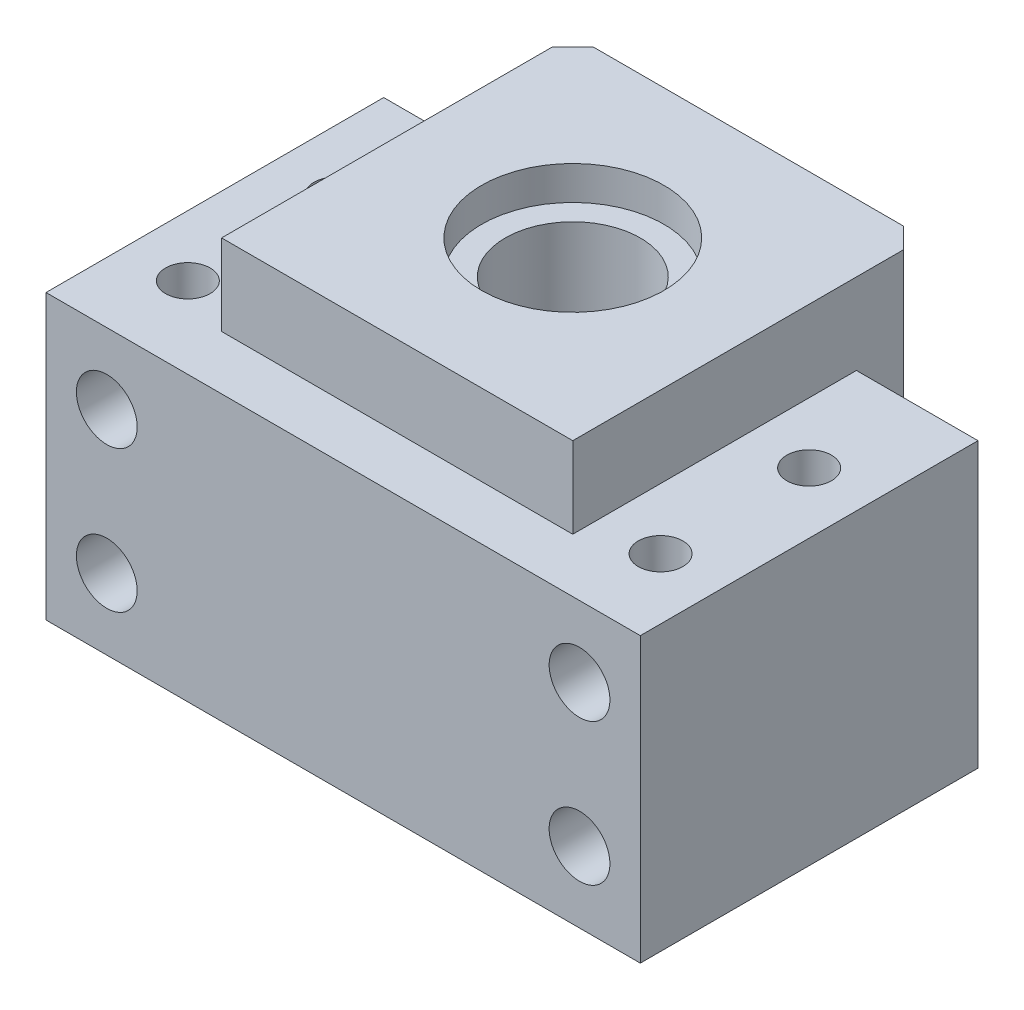
from build123d import *

# Parameters (mm, degrees)
SKETCH_1_W          = 88
SKETCH_1_H          = 50
SKETCH_1_R          = 3.3
EXTRUDE_1_DEPTH     = 42
SKETCH_2_W          = 52
SKETCH_2_H          = 52
EXTRUDE_2_DEPTH     = 54
SKETCH_3_R          = 7
CUT_EXTRUDE_1_DEPTH = 12
SKETCH_4_R          = 4.5
CUT_EXTRUDE_2_DEPTH = 80.3473377
SKETCH_5_R          = 10
CUT_EXTRUDE_3_DEPTH = 78.955115291
SKETCH_6_R          = 13.5
CUT_EXTRUDE_4_DEPTH = 5
CHAMFER_1_SIZE      = 3


with BuildPart() as part:
    # 草图1 → 凸台-拉伸1 (new body)
    with BuildSketch(Plane(origin=(0, 0, 0), x_dir=(1, 0, 0), z_dir=(0, 1, 0))):
        Rectangle(SKETCH_1_W, SKETCH_1_H)
        with Locations(Location((35, 9, 0), (0, 0, 90))):
            Circle(SKETCH_1_R, mode=Mode.SUBTRACT)
        with Locations(Location((35, -13, 0), (0, 0, 90))):
            Circle(SKETCH_1_R, mode=Mode.SUBTRACT)
        with Locations(Location((-35, -13, 0), (0, 0, 90))):
            Circle(SKETCH_1_R, mode=Mode.SUBTRACT)
        with Locations(Location((-35, 9, 0), (0, 0, 90))):
            Circle(SKETCH_1_R, mode=Mode.SUBTRACT)
    extrude(amount=EXTRUDE_1_DEPTH)

    # 草图2 → 凸台-拉伸2 (add)
    with BuildSketch(Plane(origin=(0, 0, 0), x_dir=(1, 0, 0), z_dir=(0, 1, 0))):
        with Locations((0, 9)):
            Rectangle(SKETCH_2_W, SKETCH_2_H)
    extrude(amount=EXTRUDE_2_DEPTH)

    # 草图3 → 切除-拉伸1 (cut)
    with BuildSketch(Plane(origin=(0, 0, -25), x_dir=(-1, 0, 0), z_dir=(0, 0, -1))):
        with Locations((35, 31.5)):
            Circle(SKETCH_3_R)
        with Locations((35, 10.5)):
            Circle(SKETCH_3_R)
        with Locations(Location((-35, 10.5, 0), (0, 0, 180))):
            Circle(SKETCH_3_R)
        with Locations(Location((-35, 31.5, 0), (0, 0, 180))):
            Circle(SKETCH_3_R)
    extrude(amount=-CUT_EXTRUDE_1_DEPTH, mode=Mode.SUBTRACT)

    # 草图4 → 切除-拉伸2 (cut, through all)
    with BuildSketch(Plane(origin=(0, 0, -13), x_dir=(-1, 0, 0), z_dir=(0, 0, -1))):
        with Locations((35, 31.5)):
            Circle(SKETCH_4_R)
        with Locations((35, 10.5)):
            Circle(SKETCH_4_R)
        with Locations(Location((-35, 10.5, 0), (0, 0, 180))):
            Circle(SKETCH_4_R)
        with Locations(Location((-35, 31.5, 0), (0, 0, 180))):
            Circle(SKETCH_4_R)
    extrude(amount=-CUT_EXTRUDE_2_DEPTH, mode=Mode.SUBTRACT)

    # 草图5 → 切除-拉伸3 (cut, through all)
    with BuildSketch(Plane(origin=(0, 0, 0), x_dir=(1, 0, 0), z_dir=(0, 1, 0))):
        with Locations(Location((0, 9, 0), (0, 0, 270))):
            Circle(SKETCH_5_R)
    extrude(amount=CUT_EXTRUDE_3_DEPTH, mode=Mode.SUBTRACT)

    # 草图6 → 切除-拉伸4 (cut)
    with BuildSketch(Plane(origin=(0, 54, 0), x_dir=(1, 0, 0), z_dir=(0, 1, 0))):
        with Locations(Location((0, 9, 0), (0, 0, 270))):
            Circle(SKETCH_6_R)
    extrude(amount=-CUT_EXTRUDE_4_DEPTH, mode=Mode.SUBTRACT)

    # 倒角1
    chamfer_1_edges = [part.edges().sort_by_distance(p)[0] for p in [
        (-26, 27, -35),
        (26, 27, -35),
    ]]
    chamfer(chamfer_1_edges, length=CHAMFER_1_SIZE)


solid = part.part
